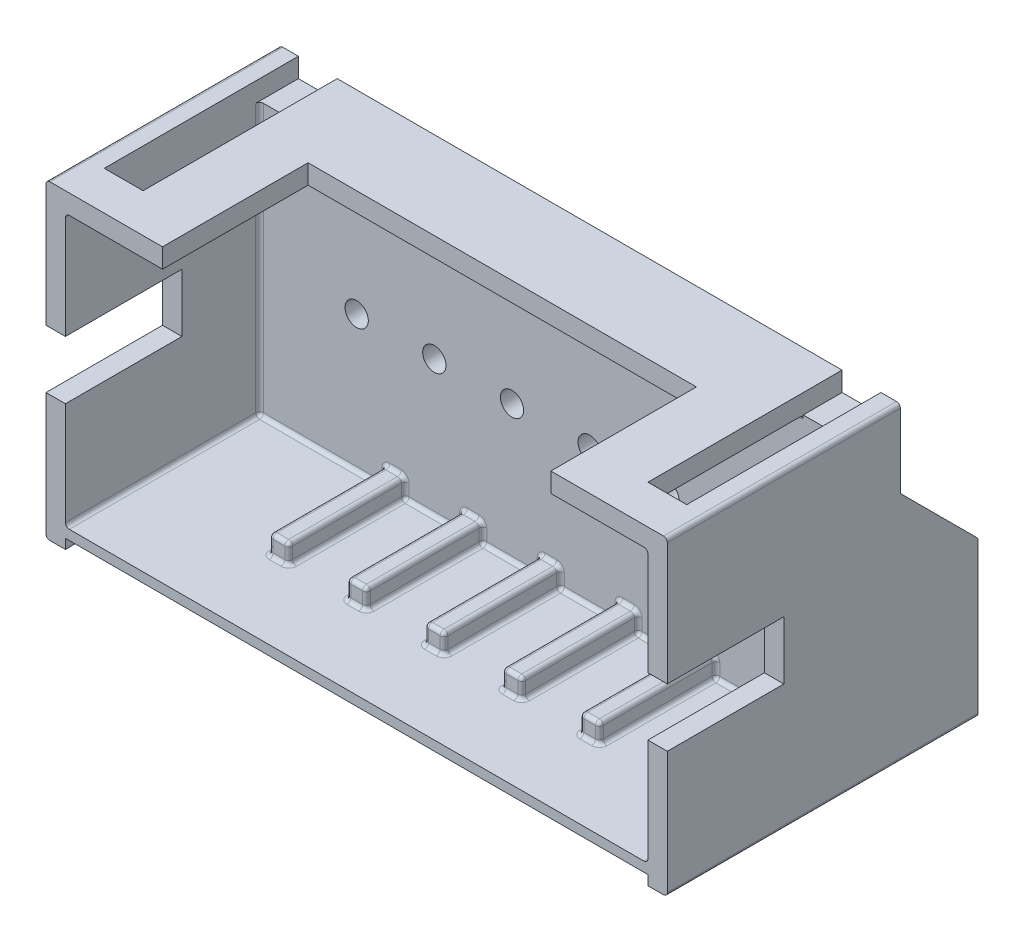
from build123d import *

# Parameters (mm, degrees)
SKETCH1_W           = 16
SKETCH1_H           = 8
SKETCH1_R           = 0.3
BOSS_EXTRUDE1_DEPTH = 8
SKETCH2_W           = 15
SKETCH2_H           = 7
CUT_EXTRUDE1_DEPTH  = 5
SKETCH4_W           = 15
SKETCH4_H           = 2
CUT_EXTRUDE2_DEPTH  = 20.595917942
CUT_EXTRUDE3_DEPTH  = 20.595917942
CUT_EXTRUDE4_REACH  = 21.596
SKETCH6_W           = 10
SKETCH6_H           = 3.749204525
SKETCH7_W           = 1
SKETCH7_H           = 5
CUT_EXTRUDE5_DEPTH  = 0.5
SKETCH8_W           = 0.5
SKETCH8_H           = 3
BOSS_EXTRUDE2_DEPTH = 0.5
SKETCH9_W           = 3
SKETCH9_H           = 1.5
CUT_EXTRUDE6_DEPTH  = 20.595917942
SKETCH10_W          = 15
SKETCH10_H          = 0.25
CUT_EXTRUDE7_DEPTH  = 20.595917942
FILLET1_R           = 0.1


with BuildPart() as part:
    # Sketch1 → Boss-Extrude1 (new body)
    with BuildSketch(Plane.XY):
        with Locations((8, 4)):
            Rectangle(SKETCH1_W, SKETCH1_H)
        with Locations((3, 4)):
            Circle(SKETCH1_R, mode=Mode.SUBTRACT)
        with Locations((5, 4)):
            Circle(SKETCH1_R, mode=Mode.SUBTRACT)
        with Locations((7, 4)):
            Circle(SKETCH1_R, mode=Mode.SUBTRACT)
        with Locations((9, 4)):
            Circle(SKETCH1_R, mode=Mode.SUBTRACT)
        with Locations((11, 4)):
            Circle(SKETCH1_R, mode=Mode.SUBTRACT)
        with Locations((13, 4)):
            Circle(SKETCH1_R, mode=Mode.SUBTRACT)
    extrude(amount=BOSS_EXTRUDE1_DEPTH)

    # Sketch2 → Cut-Extrude1 (cut)
    with BuildSketch(Plane.XY.offset(8)):
        with Locations((8, 4)):
            Rectangle(SKETCH2_W, SKETCH2_H)
    extrude(amount=-CUT_EXTRUDE1_DEPTH, mode=Mode.SUBTRACT)

    # Sketch4 → Cut-Extrude2 (cut, through all)
    with BuildSketch(Plane(origin=(0, 8, 0), x_dir=(1, 0, 0), z_dir=(0, 1, 0))):
        with Locations((8, -1)):
            Rectangle(SKETCH4_W, SKETCH4_H)
    extrude(amount=-CUT_EXTRUDE2_DEPTH, mode=Mode.SUBTRACT)

    # Sketch5 → Cut-Extrude3 (cut, through all)
    with BuildSketch(Plane(origin=(16, 0, 0), x_dir=(0, 0, -1), z_dir=(1, 0, 0))):
        Polygon((-2, 8), (0, 8), (0, 4), (-2, 6), align=None)
    extrude(amount=-CUT_EXTRUDE3_DEPTH, mode=Mode.SUBTRACT)

    # Sketch6 → Cut-Extrude4 (cut, up to next)
    with BuildSketch(Plane(origin=(0, 8, 0), x_dir=(1, 0, 0), z_dir=(0, 1, 0)), mode=Mode.PRIVATE) as cut_extrude4_sk1:
        with Locations((8, -6.125397738)):
            Rectangle(SKETCH6_W, SKETCH6_H)
    cut_extrude4_tool1 = extrude(cut_extrude4_sk1.sketch, amount=-CUT_EXTRUDE4_REACH, mode=Mode.PRIVATE) & part.part
    add(cut_extrude4_tool1.solids().sort_by_distance((8, 8, 6.125398))[0], mode=Mode.SUBTRACT)

    # Sketch7 → Cut-Extrude5 (cut)
    with BuildSketch(Plane(origin=(0, 8, 0), x_dir=(1, 0, 0), z_dir=(0, 1, 0))):
        with Locations((1, -4.5)):
            Rectangle(SKETCH7_W, SKETCH7_H)
        with Locations((15, -4.5)):
            Rectangle(SKETCH7_W, SKETCH7_H)
    extrude(amount=-CUT_EXTRUDE5_DEPTH, mode=Mode.SUBTRACT)

    # Sketch8 → Boss-Extrude2 (add)
    with BuildSketch(Plane(origin=(0, 0.5, 0), x_dir=(1, 0, 0), z_dir=(0, 1, 0))):
        with Locations((4, -4.5)):
            Rectangle(SKETCH8_W, SKETCH8_H)
        with Locations((6, -4.5)):
            Rectangle(SKETCH8_W, SKETCH8_H)
        with Locations((8, -4.5)):
            Rectangle(SKETCH8_W, SKETCH8_H)
        with Locations((10, -4.5)):
            Rectangle(SKETCH8_W, SKETCH8_H)
        with Locations((12, -4.5)):
            Rectangle(SKETCH8_W, SKETCH8_H)
    extrude(amount=BOSS_EXTRUDE2_DEPTH)

    # Sketch9 → Cut-Extrude6 (cut, through all)
    with BuildSketch(Plane(origin=(16, 0, 0), x_dir=(0, 0, -1), z_dir=(1, 0, 0))):
        with Locations((-6.5, 4)):
            Rectangle(SKETCH9_W, SKETCH9_H)
    extrude(amount=-CUT_EXTRUDE6_DEPTH, mode=Mode.SUBTRACT)

    # Sketch10 → Cut-Extrude7 (cut, through all)
    with BuildSketch(Plane.XY.offset(8)):
        with Locations((8, 0.125)):
            Rectangle(SKETCH10_W, SKETCH10_H)
    extrude(amount=-CUT_EXTRUDE7_DEPTH, mode=Mode.SUBTRACT)

    # Fillet1
    fillet1_edges = [part.edges().sort_by_distance(p)[0] for p in [
        (4.25, 0.75, 3),
        (3.75, 0.75, 3),
        (3.75, 0.5, 4.5),
        (4.25, 0.5, 4.5),
        (5.75, 0.5, 4.5),
        (6.25, 0.5, 4.5),
        (11.75, 0.5, 4.5),
        (12.25, 0.5, 4.5),
        (9.75, 0.5, 4.5),
        (10.25, 0.5, 4.5),
        (7.75, 0.5, 4.5),
        (8.25, 0.5, 4.5),
        (6.25, 0.75, 3),
        (5.75, 0.75, 3),
        (8.25, 0.75, 3),
        (7.75, 0.75, 3),
        (10.25, 0.75, 3),
        (9.75, 0.75, 3),
        (12.25, 0.75, 3),
        (11.75, 0.75, 3),
        (4.25, 1, 4.5),
        (3.75, 1, 4.5),
        (4, 1, 3),
        (3.75, 0.75, 6),
        (4, 1, 6),
        (4.25, 0.75, 6),
        (4, 0.5, 6),
        (5.75, 0.75, 6),
        (6.25, 0.75, 6),
        (6, 0.5, 6),
        (11.75, 0.75, 6),
        (12.25, 0.75, 6),
        (12, 0.5, 6),
        (9.75, 0.75, 6),
        (10.25, 0.75, 6),
        (10, 0.5, 6),
        (7.75, 0.75, 6),
        (8.25, 0.75, 6),
        (8, 0.5, 6),
        (6.25, 1, 4.5),
        (6, 1, 6),
        (5.75, 1, 4.5),
        (6, 1, 3),
        (8.25, 1, 4.5),
        (8, 1, 6),
        (7.75, 1, 4.5),
        (8, 1, 3),
        (10.25, 1, 4.5),
        (10, 1, 6),
        (9.75, 1, 4.5),
        (10, 1, 3),
        (12.25, 1, 4.5),
        (12, 1, 6),
        (11.75, 1, 4.5),
        (12, 1, 3),
        (11, 0.5, 3),
        (9, 0.5, 3),
        (7, 0.5, 3),
        (13.875, 0.5, 3),
        (15.5, 4, 3),
        (8, 7.5, 3),
        (0.5, 7.5, 7.5),
        (0.5, 4, 3),
        (5, 0.5, 3),
        (2.125, 0.5, 3),
        (0.5, 0.5, 5.5),
        (0, 0, 4),
        (16, 0, 4),
        (16, 8, 5),
        (0, 8, 5),
        (15.5, 7.5, 7.5),
        (15.75, 4, 0),
        (15.75, 6, 2),
        (0.25, 6, 2),
        (0.25, 4, 0),
        (15.5, 0.5, 5.5),
    ]]
    fillet(fillet1_edges, radius=FILLET1_R)


solid = part.part
